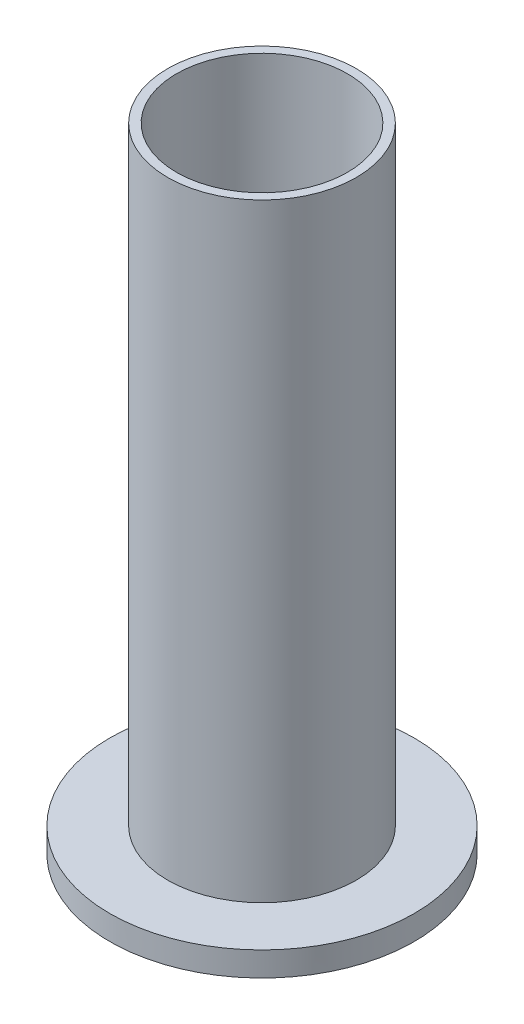
from build123d import *

# Parameters (mm, degrees)
SKETCH1_W           = 101.6
SKETCH1_H           = 101.6
BOSS_EXTRUDE1_DEPTH = 10
SKETCH2_R           = 5
CUT_EXTRUDE1_DEPTH  = 5
SKETCH3_R           = 12.5
BOSS_EXTRUDE2_DEPTH = 2
SKETCH4_R           = 7.75
BOSS_EXTRUDE3_DEPTH = 50
SKETCH6_W           = 101.6
SKETCH6_H           = 101.6
CUT_EXTRUDE2_DEPTH  = 10
SKETCH7_R           = 7.023915829
CUT_EXTRUDE3_DEPTH  = 30


with BuildPart() as part:
    # Sketch1 → Boss-Extrude1 (new body)
    with BuildSketch(Plane(origin=(0, 0, 0), x_dir=(1, 0, 0), z_dir=(0, 1, 0))):
        Rectangle(SKETCH1_W, SKETCH1_H)
    extrude(amount=BOSS_EXTRUDE1_DEPTH)

    # Sketch2 → Cut-Extrude1 (cut)
    with BuildSketch(Plane(origin=(0, 0, 0), x_dir=(-1, 0, 0), z_dir=(0, -1, 0))):
        with Locations(Location((0, 0, 0), (0, 0, 90))):
            Circle(SKETCH2_R)
    extrude(amount=-CUT_EXTRUDE1_DEPTH, mode=Mode.SUBTRACT)

    # Sketch3 → Boss-Extrude2 (add)
    with BuildSketch(Plane(origin=(0, 10, 0), x_dir=(1, 0, 0), z_dir=(0, 1, 0))):
        with Locations(Location((0, 0, 0), (0, 0, 90))):
            Circle(SKETCH3_R)
    extrude(amount=BOSS_EXTRUDE2_DEPTH)

    # Sketch4 → Boss-Extrude3 (add)
    with BuildSketch(Plane(origin=(0, 12, 0), x_dir=(1, 0, 0), z_dir=(0, 1, 0))):
        with Locations(Location((0, 0, 0), (0, 0, 270))):
            Circle(SKETCH4_R)
    extrude(amount=BOSS_EXTRUDE3_DEPTH)

    # Sketch6 → Cut-Extrude2 (cut)
    with BuildSketch(Plane(origin=(0, 10, 0), x_dir=(1, 0, 0), z_dir=(0, 1, 0))):
        Rectangle(SKETCH6_W, SKETCH6_H)
    extrude(amount=-CUT_EXTRUDE2_DEPTH, mode=Mode.SUBTRACT)

    # Sketch7 → Cut-Extrude3 (cut)
    with BuildSketch(Plane(origin=(0, 62, 0), x_dir=(1, 0, 0), z_dir=(0, 1, 0))):
        with Locations(Location((0, 0, 0), (0, 0, 270))):
            Circle(SKETCH7_R)
    extrude(amount=-CUT_EXTRUDE3_DEPTH, mode=Mode.SUBTRACT)


solid = part.part
